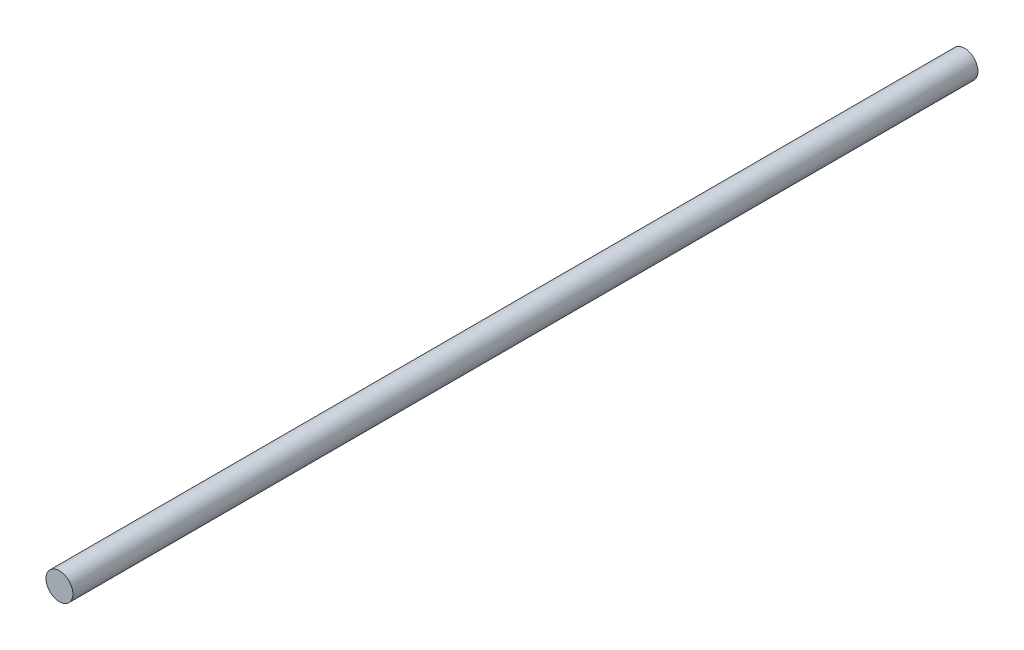
from build123d import *

# Parameters (mm, degrees)
SKETCH1_R           = 4.75
BOSS_EXTRUDE1_DEPTH = 320


with BuildPart() as part:
    # Sketch1 → Boss-Extrude1 (new body)
    with BuildSketch(Plane.XY):
        Circle(SKETCH1_R)
    extrude(amount=BOSS_EXTRUDE1_DEPTH)


solid = part.part
